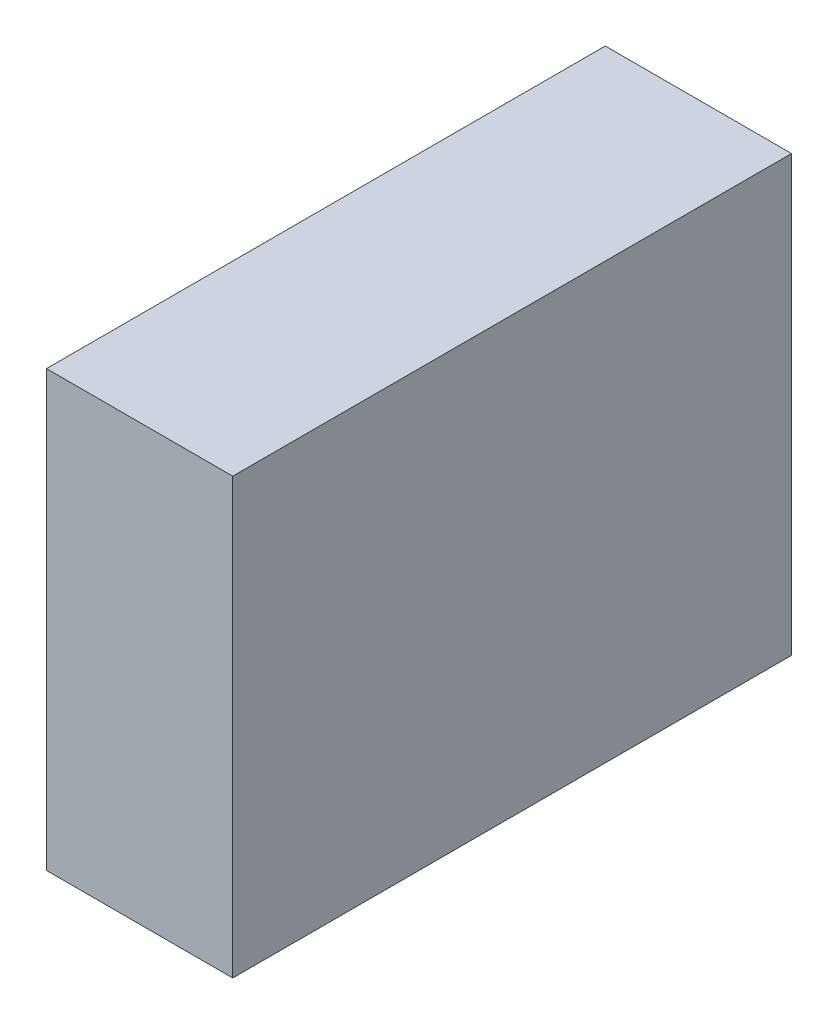
from build123d import *

# Parameters (mm, degrees)
SKETCH1_W           = 30
SKETCH1_H           = 70
BOSS_EXTRUDE1_DEPTH = 90


with BuildPart() as part:
    # Sketch1 → Boss-Extrude1 (new body)
    with BuildSketch(Plane.XY):
        with Locations((935, 525)):
            Rectangle(SKETCH1_W, SKETCH1_H)
    extrude(amount=BOSS_EXTRUDE1_DEPTH)


solid = part.part
